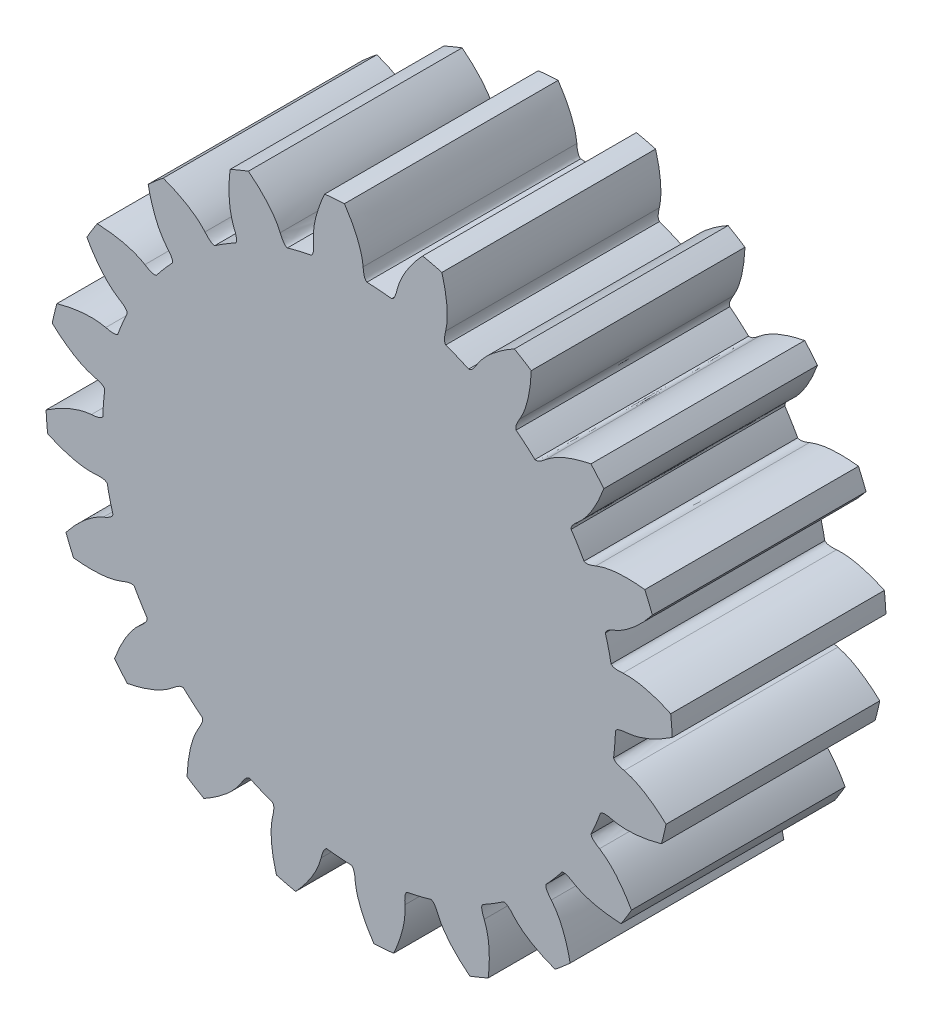
from build123d import *

# Parameters (mm, degrees)
SKETCH2_R           = 13.97
BOSS_EXTRUDE1_DEPTH = 4.7625
CUT_EXTRUDE1_DEPTH  = 22.93279337
CIRPATTERN1_COUNT   = 20


with BuildPart() as part:
    # Sketch2 → Boss-Extrude1 (new, symmetric)
    with BuildSketch(Plane.XY):
        with Locations(Location((0, 0, 0), (0, 0, 180))):
            Circle(SKETCH2_R)
    extrude(amount=BOSS_EXTRUDE1_DEPTH, both=True)

    # Sketch3 → Cut-Extrude1 (cut, symmetric)
    with BuildSketch(Plane.XY.offset(4.7625)):
        with BuildLine():
            ThreePointArc((0.345548376, 11.424775548), (0.896787464, 11.394765125), (1.445934549, 11.338173278))
            add(Edge.make_bspline(
                [(1.691022645, 11.813682598), (1.673369892, 11.72306203), (1.621683604, 11.548720261), (1.535356786, 11.380537451), (1.445934549, 11.338173278)],
                knots=[0, 0, 0, 0, 0.5, 1, 1, 1, 1], degree=3))
            add(Edge.make_bspline(
                [(2.830619385, 13.680222728), (2.615430822, 13.44971467), (2.148718568, 12.878963122), (1.796650693, 12.226075683), (1.691022645, 11.813682598)],
                knots=[0, 0, 0, 0, 0.428684194, 1, 1, 1, 1], degree=3))
            ThreePointArc((2.830619385, 13.680222728), (1.096073567, 13.926935152), (-0.65571144, 13.954602915))
            add(Edge.make_bspline(
                [(-0.65571144, 13.954602915), (-0.479231609, 13.693269885), (-0.10755057, 13.056535354), (0.138048668, 12.356610493), (0.177863767, 11.932770785)],
                knots=[0, 0, 0, 0, 0.428684194, 1, 1, 1, 1], degree=3))
            add(Edge.make_bspline(
                [(0.177863767, 11.932770785), (0.181123005, 11.840504407), (0.204899888, 11.660223557), (0.263854291, 11.480606868), (0.345548376, 11.424775548)],
                knots=[0, 0, 0, 0, 0.5, 1, 1, 1, 1], degree=3))
        make_face()
    cut_extrude1 = extrude(amount=CUT_EXTRUDE1_DEPTH, both=True, mode=Mode.SUBTRACT)

    # CirPattern1: Cut-Extrude1 ×20 about axis
    cirpattern1_axis = Axis((0, 0, 4.7625), (0, 0, -1))
    for i in range(1, CIRPATTERN1_COUNT):
        add(cut_extrude1.rotate(cirpattern1_axis, i * 360 / CIRPATTERN1_COUNT), mode=Mode.SUBTRACT)


solid = part.part
